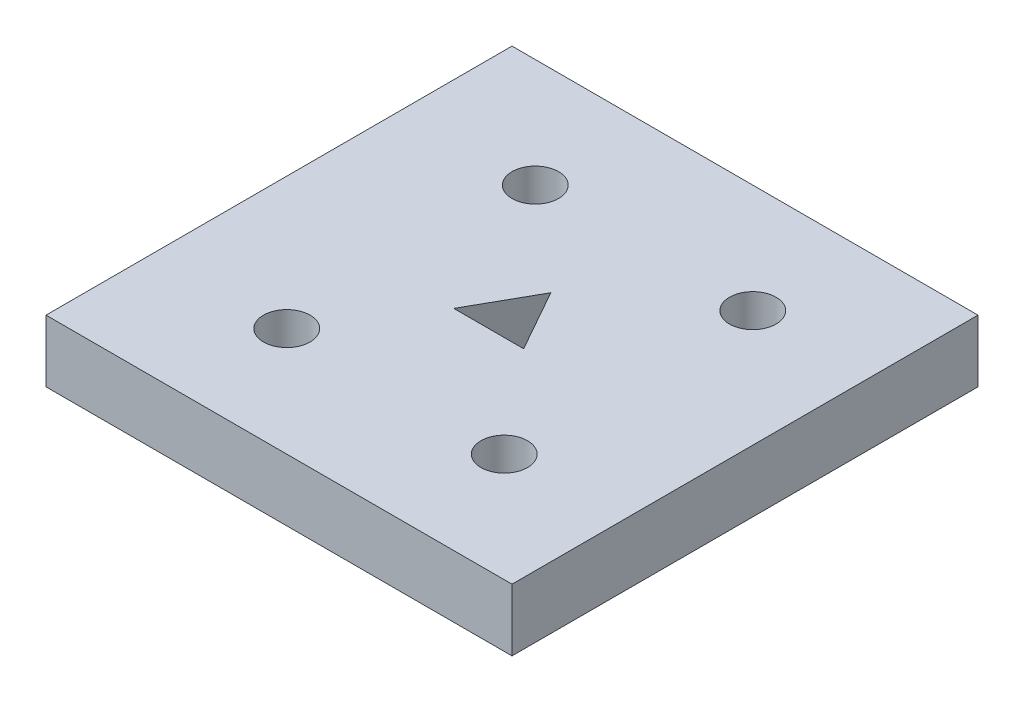
from build123d import *

# Parameters (mm, degrees)
SKETCH_1_W      = 30
SKETCH_1_H      = 30
SKETCH_1_R      = 1.5
EXTRUDE_1_DEPTH = 4


with BuildPart() as part:
    # 草图1 → 凸台-拉伸1 (new body)
    with BuildSketch(Plane(origin=(0, 0, 0), x_dir=(1, 0, 0), z_dir=(0, 1, 0))):
        with Locations((15, -15)):
            Rectangle(SKETCH_1_W, SKETCH_1_H)
        with Locations(Location((8.5, -7, 0), (0, 0, 270))):
            Circle(SKETCH_1_R, mode=Mode.SUBTRACT)
        with Locations(Location((22.5, -7, 0), (0, 0, 270))):
            Circle(SKETCH_1_R, mode=Mode.SUBTRACT)
        with Locations(Location((22.5, -23, 0), (0, 0, 90))):
            Circle(SKETCH_1_R, mode=Mode.SUBTRACT)
        with Locations(Location((8.5, -23, 0), (0, 0, 90))):
            Circle(SKETCH_1_R, mode=Mode.SUBTRACT)
        Polygon((15, -12.5), (12.75, -16.5), (17.25, -16.5), align=None, mode=Mode.SUBTRACT)
    extrude(amount=EXTRUDE_1_DEPTH)


solid = part.part
